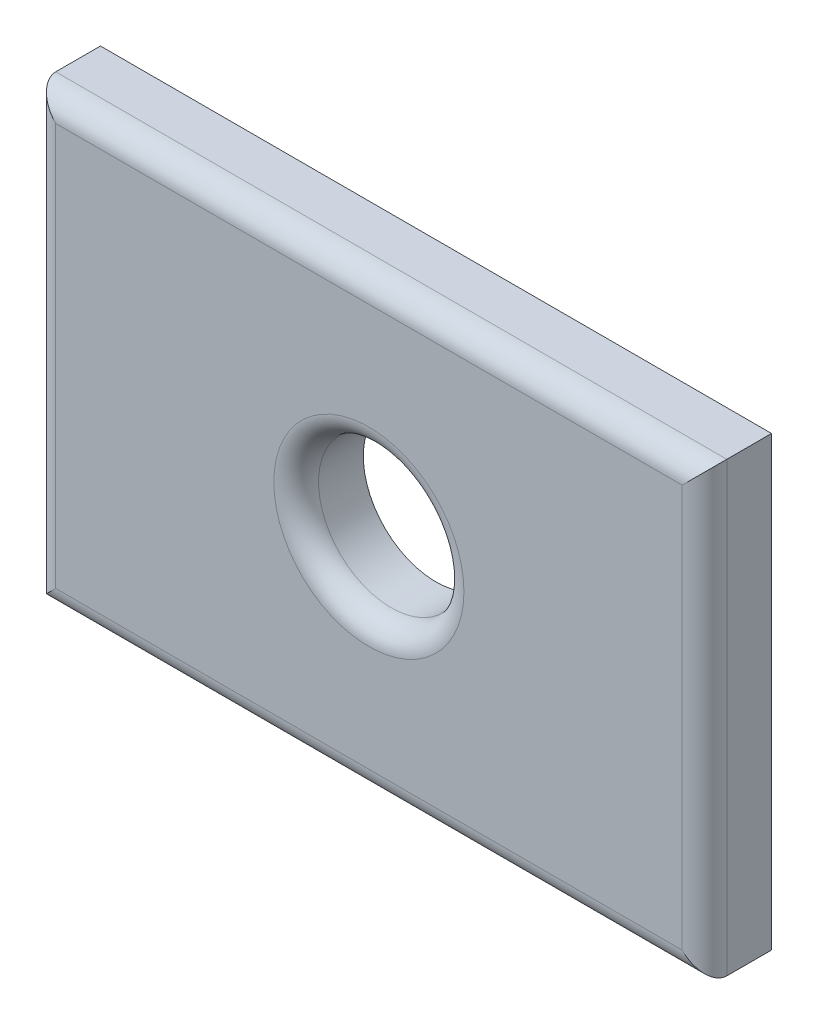
from build123d import *

# Parameters (mm, degrees)
ESQUISSE1_W             = 30
ESQUISSE1_H             = 20
BOSS_EXTRU_1_DEPTH      = 3
ESQUISSE2_R             = 3.25
ENL_V_MAT_EXTRU_1_DEPTH = 3
CONG_1_R                = 1


with BuildPart() as part:
    # Esquisse1 → Boss.-Extru.1 (new body)
    with BuildSketch(Plane.XY):
        with Locations((-5.07782823, -0.973871734)):
            Rectangle(ESQUISSE1_W, ESQUISSE1_H)
    extrude(amount=BOSS_EXTRU_1_DEPTH)

    # Esquisse2 → Enlèv. mat.-Extru.1 (cut)
    with BuildSketch(Plane.XY.offset(3)):
        with Locations((-5.07782823, -0.973871734)):
            Circle(ESQUISSE2_R)
    extrude(amount=-ENL_V_MAT_EXTRU_1_DEPTH, mode=Mode.SUBTRACT)

    # Congé1
    cong_1_edges = [part.edges().sort_by_distance(p)[0] for p in [
        (9.92217177, -0.973871734, 3),
        (-5.07782823, 9.026128266, 3),
        (-8.32782823, -0.973871734, 3),
        (-20.07782823, -0.973871734, 3),
        (-5.07782823, -10.973871734, 3),
    ]]
    fillet(cong_1_edges, radius=CONG_1_R)


solid = part.part
